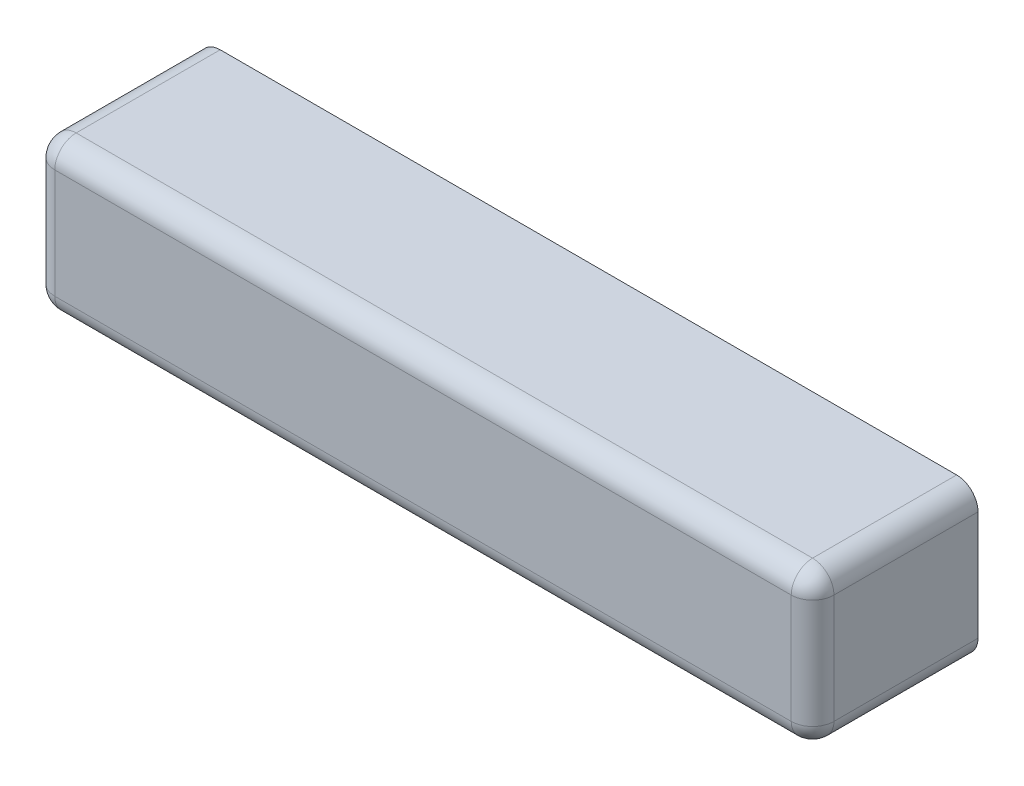
from build123d import *

# Parameters (mm, degrees)
SKETCH1_W           = 29.2
SKETCH1_H           = 5.7
BOSS_EXTRUDE1_DEPTH = 6.2
FILLET1_R           = 0.8


with BuildPart() as part:
    # Sketch1 → Boss-Extrude1 (new body)
    with BuildSketch(Plane.XY):
        with Locations((14.6, 2.85)):
            Rectangle(SKETCH1_W, SKETCH1_H)
    extrude(amount=BOSS_EXTRUDE1_DEPTH)

    # Fillet1
    fillet1_edges = [part.edges().sort_by_distance(p)[0] for p in [
        (29.2, 2.85, 6.2),
        (14.6, 5.7, 6.2),
        (0, 2.85, 6.2),
        (14.6, 0, 6.2),
        (0, 5.7, 3.1),
        (29.2, 5.7, 3.1),
        (29.2, 0, 3.1),
        (0, 0, 3.1),
    ]]
    fillet(fillet1_edges, radius=FILLET1_R)


solid = part.part
